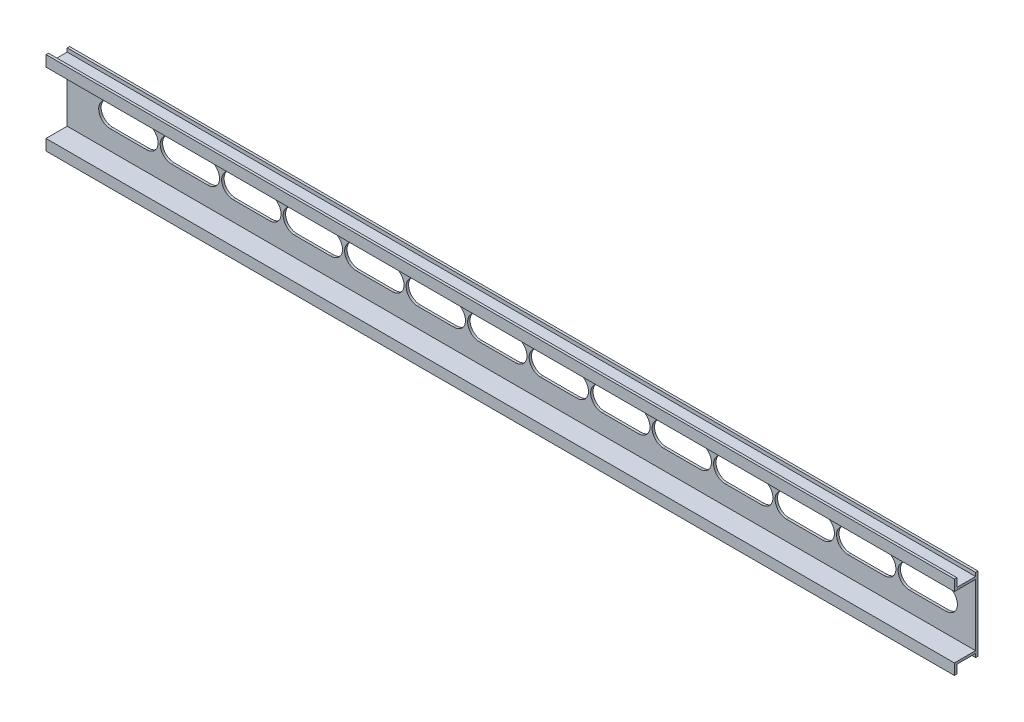
from build123d import *

# Parameters (mm, degrees)
BOSS_EXTRUDE1_DEPTH = 381
CUT_EXTRUDE1_DEPTH  = 382.531505268


with BuildPart() as part:
    # Sketch1 → Boss-Extrude1 (new body)
    with BuildSketch(Plane(origin=(0, 0, 0), x_dir=(0, 0, -1), z_dir=(1, 0, 0))):
        Polygon((0, 12.954), (0, -12.954), (-8.89, -12.954), (-8.89, -17.526), (-7.874, -17.526), (-7.874, -13.97), (0, -13.97), (0, -15.494), (1.016, -15.494), (1.016, 15.494), (0, 15.494), (0, 13.97), (-7.874, 13.97), (-7.874, 17.526), (-8.89, 17.526), (-8.89, 12.954), align=None)
    extrude(amount=BOSS_EXTRUDE1_DEPTH)

    # Sketch2 → Cut-Extrude1 (cut, through all)
    with BuildSketch(Plane(origin=(0, 0, -1.016), x_dir=(-1, 0, 0), z_dir=(0, 0, -1))):
        with BuildLine():
            Line((-368.554, 4.826), (-353.314, 4.826))
            ThreePointArc((-353.314, 4.826), (-348.488, 0), (-353.314, -4.826))
            Line((-353.314, -4.826), (-368.554, -4.826))
            ThreePointArc((-368.554, -4.826), (-373.38, 0), (-368.554, 4.826))
        make_face()
        with BuildLine():
            Line((-342.763230769, 4.826), (-327.523230769, 4.826))
            ThreePointArc((-327.523230769, 4.826), (-322.697230769, 0), (-327.523230769, -4.826))
            Line((-327.523230769, -4.826), (-342.763230769, -4.826))
            ThreePointArc((-342.763230769, -4.826), (-347.589230769, 0), (-342.763230769, 4.826))
        make_face()
        with BuildLine():
            Line((-316.972461538, 4.826), (-301.732461538, 4.826))
            ThreePointArc((-301.732461538, 4.826), (-296.906461538, 0), (-301.732461538, -4.826))
            Line((-301.732461538, -4.826), (-316.972461538, -4.826))
            ThreePointArc((-316.972461538, -4.826), (-321.798461538, 0), (-316.972461538, 4.826))
        make_face()
        with BuildLine():
            Line((-291.181692308, 4.826), (-275.941692308, 4.826))
            ThreePointArc((-275.941692308, 4.826), (-271.115692308, 0), (-275.941692308, -4.826))
            Line((-275.941692308, -4.826), (-291.181692308, -4.826))
            ThreePointArc((-291.181692308, -4.826), (-296.007692308, 0), (-291.181692308, 4.826))
        make_face()
        with BuildLine():
            Line((-265.390923077, 4.826), (-250.150923077, 4.826))
            ThreePointArc((-250.150923077, 4.826), (-245.324923077, 0), (-250.150923077, -4.826))
            Line((-250.150923077, -4.826), (-265.390923077, -4.826))
            ThreePointArc((-265.390923077, -4.826), (-270.216923077, 0), (-265.390923077, 4.826))
        make_face()
        with BuildLine():
            Line((-239.600153846, 4.826), (-224.360153846, 4.826))
            ThreePointArc((-224.360153846, 4.826), (-219.534153846, 0), (-224.360153846, -4.826))
            Line((-224.360153846, -4.826), (-239.600153846, -4.826))
            ThreePointArc((-239.600153846, -4.826), (-244.426153846, 0), (-239.600153846, 4.826))
        make_face()
        with BuildLine():
            Line((-213.809384615, 4.826), (-198.569384615, 4.826))
            ThreePointArc((-198.569384615, 4.826), (-193.743384615, 0), (-198.569384615, -4.826))
            Line((-198.569384615, -4.826), (-213.809384615, -4.826))
            ThreePointArc((-213.809384615, -4.826), (-218.635384615, 0), (-213.809384615, 4.826))
        make_face()
        with BuildLine():
            Line((-188.018615385, 4.826), (-172.778615385, 4.826))
            ThreePointArc((-172.778615385, 4.826), (-167.952615385, 0), (-172.778615385, -4.826))
            Line((-172.778615385, -4.826), (-188.018615385, -4.826))
            ThreePointArc((-188.018615385, -4.826), (-192.844615385, 0), (-188.018615385, 4.826))
        make_face()
        with BuildLine():
            Line((-162.227846154, 4.826), (-146.987846154, 4.826))
            ThreePointArc((-146.987846154, 4.826), (-142.161846154, 0), (-146.987846154, -4.826))
            Line((-146.987846154, -4.826), (-162.227846154, -4.826))
            ThreePointArc((-162.227846154, -4.826), (-167.053846154, 0), (-162.227846154, 4.826))
        make_face()
        with BuildLine():
            Line((-136.437076923, 4.826), (-121.197076923, 4.826))
            ThreePointArc((-121.197076923, 4.826), (-116.371076923, 0), (-121.197076923, -4.826))
            Line((-121.197076923, -4.826), (-136.437076923, -4.826))
            ThreePointArc((-136.437076923, -4.826), (-141.263076923, 0), (-136.437076923, 4.826))
        make_face()
        with BuildLine():
            Line((-110.646307692, 4.826), (-95.406307692, 4.826))
            ThreePointArc((-95.406307692, 4.826), (-90.580307692, 0), (-95.406307692, -4.826))
            Line((-95.406307692, -4.826), (-110.646307692, -4.826))
            ThreePointArc((-110.646307692, -4.826), (-115.472307692, 0), (-110.646307692, 4.826))
        make_face()
        with BuildLine():
            Line((-84.855538462, 4.826), (-69.615538462, 4.826))
            ThreePointArc((-69.615538462, 4.826), (-64.789538462, 0), (-69.615538462, -4.826))
            Line((-69.615538462, -4.826), (-84.855538462, -4.826))
            ThreePointArc((-84.855538462, -4.826), (-89.681538462, 0), (-84.855538462, 4.826))
        make_face()
        with BuildLine():
            Line((-59.064769231, 4.826), (-43.824769231, 4.826))
            ThreePointArc((-43.824769231, 4.826), (-38.998769231, 0), (-43.824769231, -4.826))
            Line((-43.824769231, -4.826), (-59.064769231, -4.826))
            ThreePointArc((-59.064769231, -4.826), (-63.890769231, 0), (-59.064769231, 4.826))
        make_face()
        with BuildLine():
            Line((-33.274, 4.826), (-18.034, 4.826))
            ThreePointArc((-18.034, 4.826), (-13.208, 0), (-18.034, -4.826))
            Line((-18.034, -4.826), (-33.274, -4.826))
            ThreePointArc((-33.274, -4.826), (-38.1, 0), (-33.274, 4.826))
        make_face()
    extrude(amount=-CUT_EXTRUDE1_DEPTH, mode=Mode.SUBTRACT)


solid = part.part
